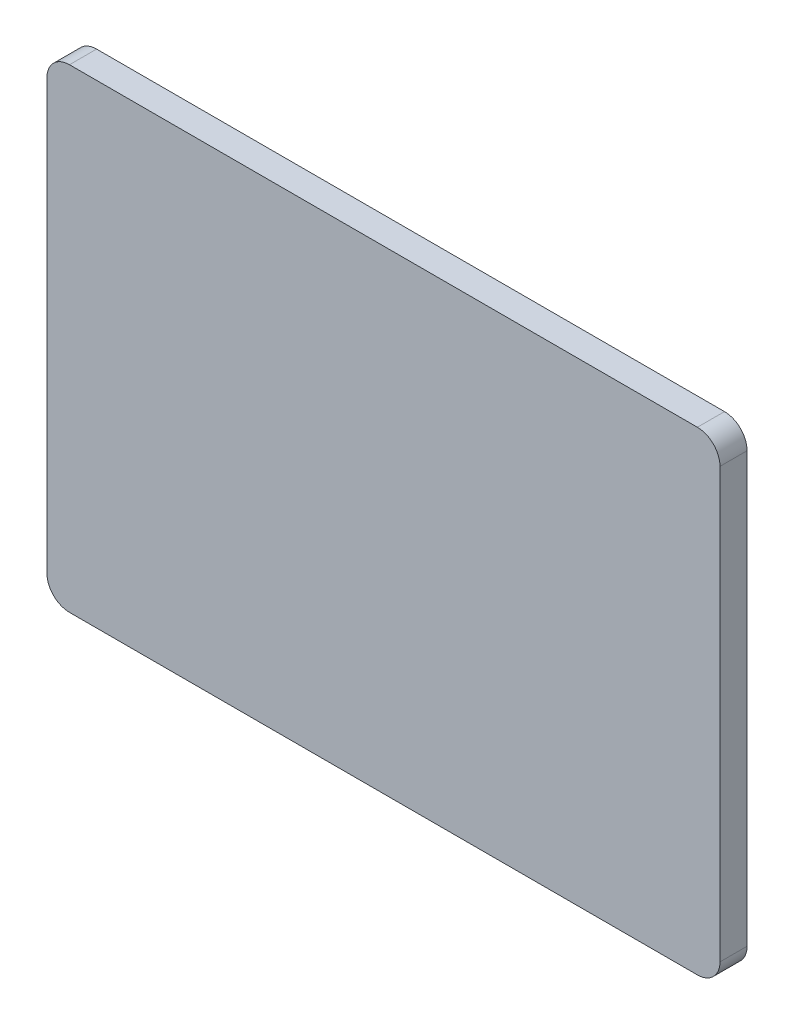
from build123d import *

# Parameters (mm, degrees)
ESQUISSE1_W        = 298
ESQUISSE1_H        = 210
BOSS_EXTRU_1_DEPTH = 12
CONG_1_R           = 10


with BuildPart() as part:
    # Esquisse1 → Boss.-Extru.1 (new body)
    with BuildSketch(Plane.XY):
        with Locations((149, 105)):
            Rectangle(ESQUISSE1_W, ESQUISSE1_H)
    extrude(amount=BOSS_EXTRU_1_DEPTH)

    # Congé1
    cong_1_edges = [part.edges().sort_by_distance(p)[0] for p in [
        (0, 210, 6),
        (298, 210, 6),
        (298, 0, 6),
        (0, 0, 6),
    ]]
    fillet(cong_1_edges, radius=CONG_1_R)


solid = part.part
